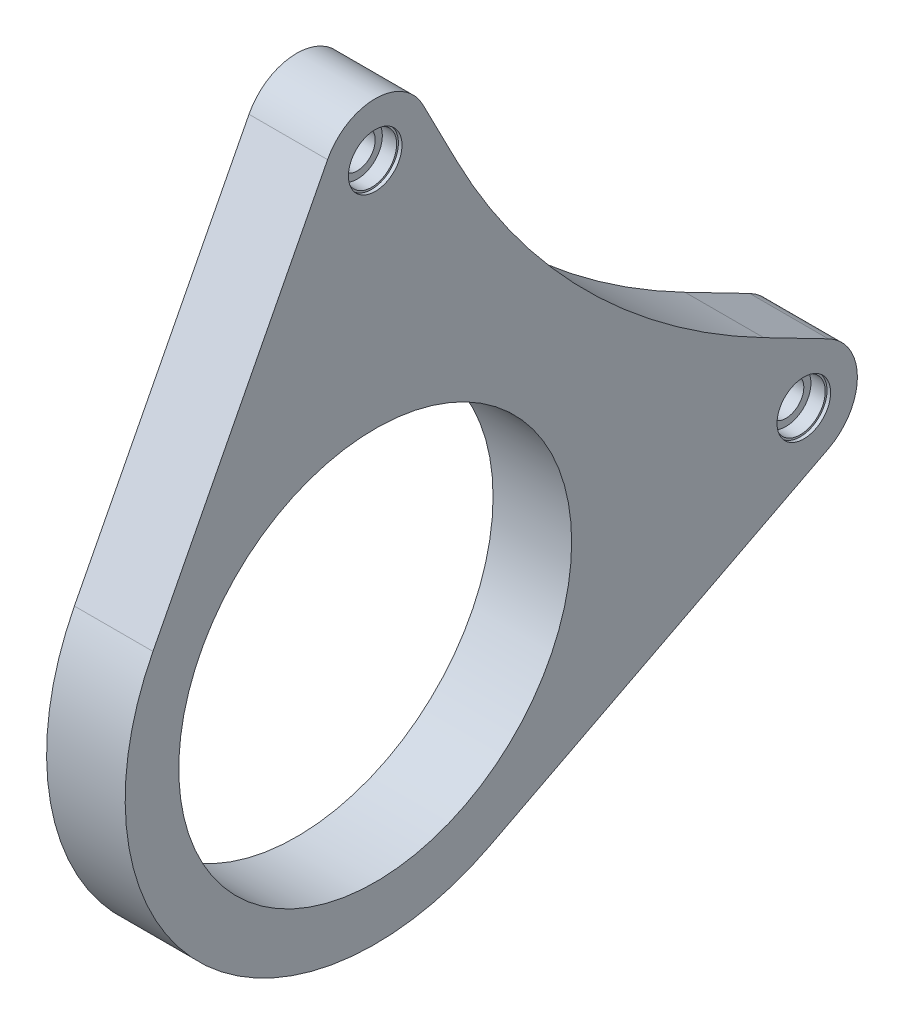
from build123d import *

# Parameters (mm, degrees)
SKETCH1_R                                  = 55
SKETCH1_R_2                                = 5
BOSS_EXTRUDE1_DEPTH                        = 11
SKETCH2_R                                  = 7.5
CUT_EXTRUDE1_DEPTH                         = 1
SKETCH3_R                                  = 7
CUT_EXTRUDE2_DEPTH                         = 4
MIRROR1_AT_THE_SECOND_PLANE_COPY_1_SKETC_R = 7.5
MIRROR1_AT_THE_SECOND_PLANE_COPY_1_DEPTH   = 1
MIRROR1_AT_THE_SECOND_PLANE_COPY_2_SKETC_R = 7
MIRROR1_AT_THE_SECOND_PLANE_COPY_2_DEPTH   = 4
FILLET1_R                                  = 200


with BuildPart() as part:
    # Sketch1 → Boss-Extrude1 (new, symmetric)
    with BuildSketch(Plane(origin=(0, 0, 0), x_dir=(0, 0, -1), z_dir=(1, 0, 0))):
        with BuildLine():
            Line((-62.214626272, 32.083333333), (-13.33170563, 126.875))
            ThreePointArc((-13.33170563, 126.875), (0, 135), (13.33170563, 126.875))
            Line((13.33170563, 126.875), (51.962948302, 51.962948302))
            Line((51.962948302, 51.962948302), (126.875, 13.33170563))
            ThreePointArc((126.875, 13.33170563), (135, 0), (126.875, -13.33170563))
            Line((126.875, -13.33170563), (32.083333333, -62.214626272))
            ThreePointArc((32.083333333, -62.214626272), (-49.497474683, -49.497474683), (-62.214626272, 32.083333333))
        make_face()
        Circle(SKETCH1_R, mode=Mode.SUBTRACT)
        with Locations((0, 120)):
            Circle(SKETCH1_R_2, mode=Mode.SUBTRACT)
        with Locations((120, 0)):
            Circle(SKETCH1_R_2, mode=Mode.SUBTRACT)
    extrude(amount=BOSS_EXTRUDE1_DEPTH, both=True)

    # Sketch2 → Cut-Extrude1 (cut)
    with BuildSketch(Plane(origin=(11, 0, 0), x_dir=(0, 0, -1), z_dir=(1, 0, 0))):
        with Locations((0, 120)):
            Circle(SKETCH2_R)
    cut_extrude1 = extrude(amount=-CUT_EXTRUDE1_DEPTH, mode=Mode.SUBTRACT)

    # Sketch3 → Cut-Extrude2 (cut)
    with BuildSketch(Plane(origin=(10, 0, 0), x_dir=(0, 0, -1), z_dir=(1, 0, 0))):
        with Locations((0, 120)):
            Circle(SKETCH3_R)
    cut_extrude2 = extrude(amount=-CUT_EXTRUDE2_DEPTH, mode=Mode.SUBTRACT)

    # Mirror1: Cut-Extrude1, Cut-Extrude2 across plane
    add(cut_extrude1.mirror(Plane(origin=(0, 0, 0), x_dir=(0, -0.7071067811865464, 0.7071067811865487), z_dir=(0, -0.7071067811865487, -0.7071067811865464))), mode=Mode.SUBTRACT)
    add(cut_extrude2.mirror(Plane(origin=(0, 0, 0), x_dir=(0, -0.7071067811865464, 0.7071067811865487), z_dir=(0, -0.7071067811865487, -0.7071067811865464))), mode=Mode.SUBTRACT)

    # Mirror1 at the second plane: Cut-Extrude1, Cut-Extrude2 across plane
    add(cut_extrude1.mirror(Plane(origin=(0, 0, 0), x_dir=(0, 0, 1), z_dir=(1, 0, 0))), mode=Mode.SUBTRACT)
    add(cut_extrude2.mirror(Plane(origin=(0, 0, 0), x_dir=(0, 0, 1), z_dir=(1, 0, 0))), mode=Mode.SUBTRACT)

    # Mirror1 at the second plane copy 1 sketc → Mirror1 at the second plane copy 1 (cut)
    with BuildSketch(Plane(origin=(-11, 0, 0), x_dir=(0, 1, 0), z_dir=(-1, 0, 0))):
        with Locations((0, 120)):
            Circle(MIRROR1_AT_THE_SECOND_PLANE_COPY_1_SKETC_R)
    extrude(amount=-MIRROR1_AT_THE_SECOND_PLANE_COPY_1_DEPTH, mode=Mode.SUBTRACT)

    # Mirror1 at the second plane copy 2 sketc → Mirror1 at the second plane copy 2 (cut)
    with BuildSketch(Plane(origin=(-10, 0, 0), x_dir=(0, 1, 0), z_dir=(-1, 0, 0))):
        with Locations((0, 120)):
            Circle(MIRROR1_AT_THE_SECOND_PLANE_COPY_2_SKETC_R)
    extrude(amount=-MIRROR1_AT_THE_SECOND_PLANE_COPY_2_DEPTH, mode=Mode.SUBTRACT)

    # Fillet1
    fillet1_edges = [part.edges().sort_by_distance(p)[0] for p in [
        (0, 51.962948302, -51.962948302),
    ]]
    fillet(fillet1_edges, radius=FILLET1_R)


solid = part.part
